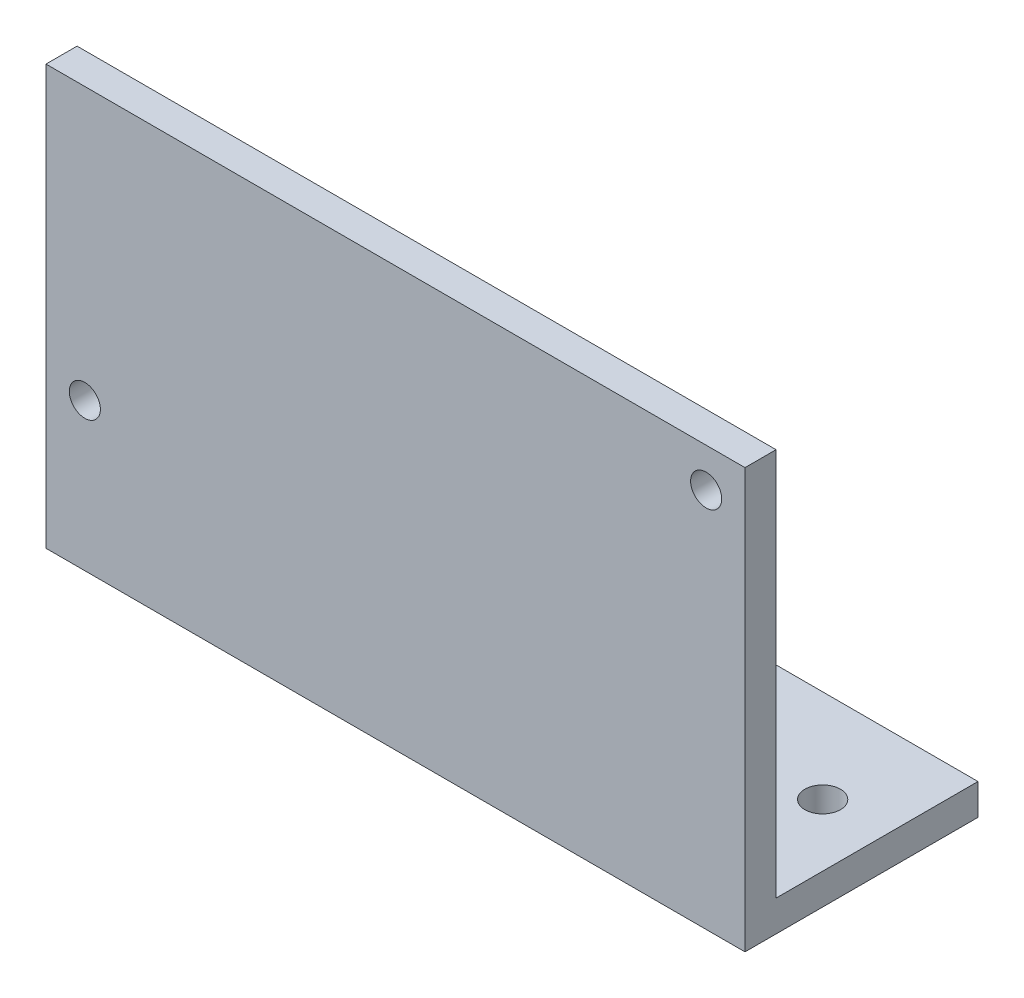
from build123d import *

# Parameters (mm, degrees)
SKETCH1_W           = 45
SKETCH1_H           = 25
SKETCH1_H_2         = 2
BOSS_EXTRUDE3_DEPTH = 2
SKETCH6_W           = 45
SKETCH6_H           = 2
BOSS_EXTRUDE4_DEPTH = 15
SKETCH7_R           = 1
CUT_EXTRUDE1_DEPTH  = 18
SKETCH9_R           = 1
SKETCH9_R_2         = 1.144474258
CUT_EXTRUDE3_DEPTH  = 18
SCALE1_SCALE        = 0.75


with BuildPart() as part:
    # Sketch1 → Boss-Extrude3 (new body)
    with BuildSketch(Plane.XY):
        Rectangle(SKETCH1_W, SKETCH1_H)
        with Locations((0, -13.5)):
            Rectangle(SKETCH1_W, SKETCH1_H_2)
    extrude(amount=BOSS_EXTRUDE3_DEPTH)

    # Sketch6 → Boss-Extrude4 (add)
    with BuildSketch(Plane.XY.offset(2)):
        with Locations((0, -13.5)):
            Rectangle(SKETCH6_W, SKETCH6_H)
    extrude(amount=-BOSS_EXTRUDE4_DEPTH)

    # Sketch7 → Cut-Extrude1 (cut)
    with BuildSketch(Plane(origin=(0, 0, 0), x_dir=(-1, 0, 0), z_dir=(0, 0, -1))):
        with Locations((-20, 10)):
            Circle(SKETCH7_R)
        with Locations((20, -5)):
            Circle(SKETCH7_R)
    extrude(amount=-CUT_EXTRUDE1_DEPTH, mode=Mode.SUBTRACT)

    # Sketch9 → Cut-Extrude3 (cut)
    with BuildSketch(Plane(origin=(0, -12.5, 0), x_dir=(1, 0, 0), z_dir=(0, 1, 0))):
        with Locations(Location((-18.5, 7, 0), (0, 0, 180))):
            Circle(SKETCH9_R)
        with Locations(Location((18.5, 7, 0), (0, 0, 180))):
            Circle(SKETCH9_R_2)
    extrude(amount=-CUT_EXTRUDE3_DEPTH, mode=Mode.SUBTRACT)


with BuildPart() as part_1:
    # Scale1: scaled about (-0.010079513, -5.05482545, -1.423478353)
    add(part.part.scale(SCALE1_SCALE).moved(Location((-0.002519878, -1.263706363, -0.355869588))))


solid = part_1.part
